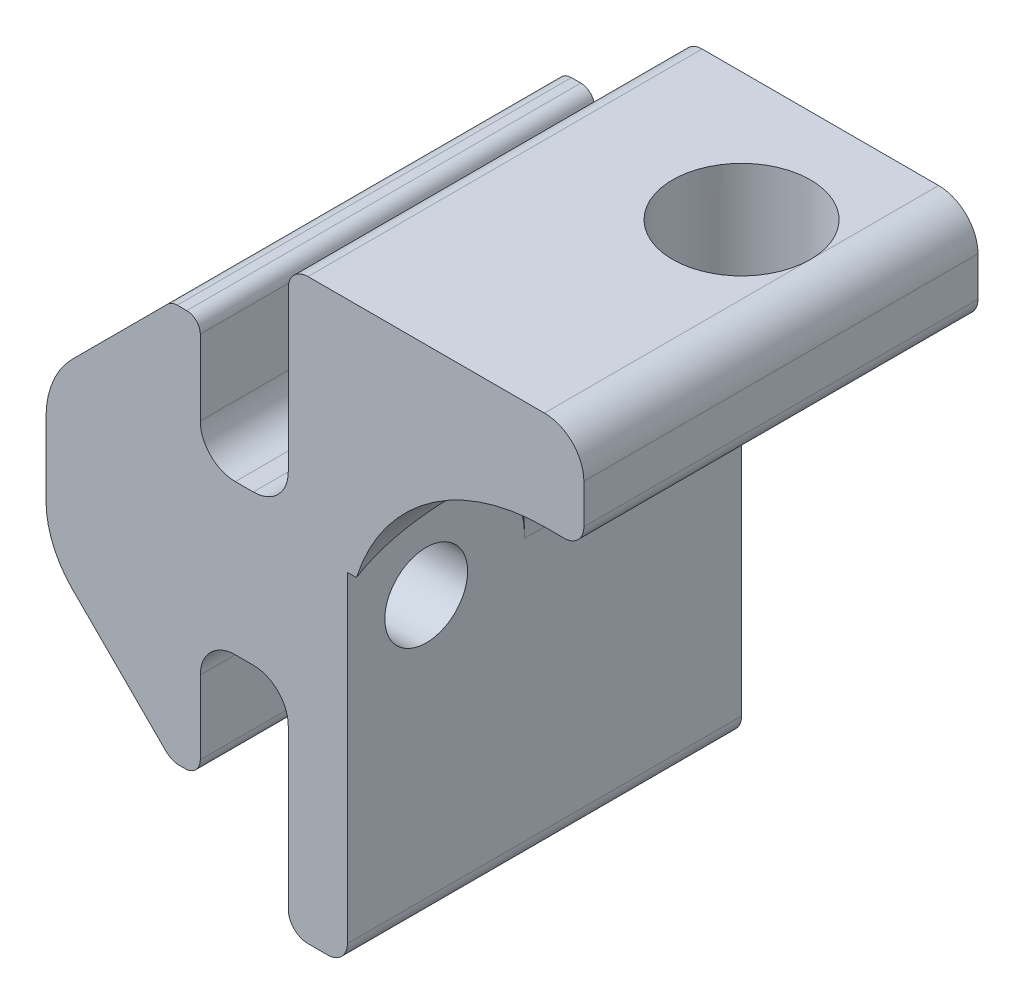
from build123d import *

# Parameters (mm, degrees)
BOSS_EXTRUDE1_DEPTH = 20
SKETCH2_R           = 3.5
CUT_EXTRUDE1_DEPTH  = 65.034014806
SKETCH3_R           = 2.1
CUT_EXTRUDE2_DEPTH  = 43.075221337
SKETCH4_R           = 5
CUT_EXTRUDE3_DEPTH  = 20


with BuildPart() as part:
    # Sketch1 → Boss-Extrude1 (new body)
    with BuildSketch(Plane.XY):
        with BuildLine():
            Line((38.3, 9.881410941), (38.3, 10.745623604))
            Line((38.3, 10.745623604), (38.3, 13.469803951))
            ThreePointArc((38.3, 13.469803951), (37.780173115, 14.724777066), (36.5252, 15.244603951))
            Line((36.5252, 15.244603951), (35.610800366, 15.244603951))
            ThreePointArc((35.610800366, 15.244603951), (34.355826992, 14.724776959), (33.836, 13.469803585))
            Line((33.836, 13.469803585), (33.836, 9.738724213))
            ThreePointArc((33.836, 9.738724213), (33.608795638, 9.190204362), (33.060275787, 8.963))
            Line((33.060275787, 8.963), (32.786933649, 8.963))
            ThreePointArc((32.786933649, 8.963), (32.409953896, 9.037986056), (32.090366071, 9.25152824))
            Line((32.090366071, 9.25152824), (27.33900161, 14.002904388))
            ThreePointArc((27.33900161, 14.002904388), (26.352731832, 15.478964368), (26.0064, 17.220094864))
            Line((26.0064, 17.220094864), (26.0064, 20.879905136))
            ThreePointArc((26.0064, 20.879905136), (26.352731832, 22.621035632), (27.33900161, 24.097095612))
            Line((27.33900161, 24.097095612), (32.177090071, 28.935195973))
            ThreePointArc((32.177090071, 28.935195973), (32.400617966, 29.084552836), (32.664287242, 29.137))
            Line((32.664287242, 29.137), (33.147, 29.137))
            ThreePointArc((33.147, 29.137), (33.634196572, 28.935196572), (33.836, 28.448))
            Line((33.836, 28.448), (33.836, 24.630196049))
            ThreePointArc((33.836, 24.630196049), (34.355826885, 23.375222934), (35.6108, 22.855396049))
            Line((35.6108, 22.855396049), (36.525200183, 22.855396049))
            ThreePointArc((36.525200183, 22.855396049), (37.780173169, 23.37522288), (38.3, 24.630195866))
            Line((38.3, 24.630195866), (38.3, 27.353495632))
            Line((38.3, 27.353495632), (38.3, 28.215588568))
            Line((38.3, 28.215588568), (38.3, 32.710978016))
            ThreePointArc((38.3, 32.710978016), (38.592893219, 33.418084798), (39.3, 33.710978016))
            Line((39.3, 33.710978016), (41.3, 33.710978016))
            Line((41.3, 33.710978016), (51.3, 33.710978016))
            ThreePointArc((51.3, 33.710978016), (52.714213562, 33.125191579), (53.3, 31.710978016))
            Line((53.3, 31.710978016), (53.3, 29.710978016))
            ThreePointArc((53.3, 29.710978016), (53.007106781, 29.003871235), (52.3, 28.710978016))
            Line((52.3, 28.710978016), (51.3, 28.710978016))
            ThreePointArc((51.3, 28.710978016), (44.228932188, 25.782045828), (41.3, 18.710978016))
            Line((41.3, 18.710978016), (41.3, 5.394343623))
            ThreePointArc((41.3, 5.394343623), (41.007106781, 4.687236842), (40.3, 4.394343623))
            Line((40.3, 4.394343623), (39.3, 4.394343623))
            ThreePointArc((39.3, 4.394343623), (38.592893219, 4.687236842), (38.3, 5.394343623))
            Line((38.3, 5.394343623), (38.3, 9.881410941))
        make_face()
    extrude(amount=-BOSS_EXTRUDE1_DEPTH)

    # Sketch2 → Cut-Extrude1 (cut, through all)
    with BuildSketch(Plane(origin=(0, 33.710978016, 0), x_dir=(1, 0, 0), z_dir=(0, 1, 0))):
        with Locations((47.8, 13.5)):
            Circle(SKETCH2_R)
    extrude(amount=-CUT_EXTRUDE1_DEPTH, mode=Mode.SUBTRACT)

    # Sketch3 → Cut-Extrude2 (cut, through all)
    with BuildSketch(Plane(origin=(41.3, 0, 0), x_dir=(0, 0, -1), z_dir=(1, 0, 0))):
        with Locations((4, 18.710978016)):
            Circle(SKETCH3_R)
    extrude(amount=-CUT_EXTRUDE2_DEPTH, mode=Mode.SUBTRACT)

    # Sketch4 → Cut-Extrude3 (cut)
    with BuildSketch(Plane.ZY.offset(-41.3)):
        with Locations((-4, 18.710978016)):
            Circle(SKETCH4_R)
    extrude(amount=-CUT_EXTRUDE3_DEPTH, mode=Mode.SUBTRACT)


solid = part.part
